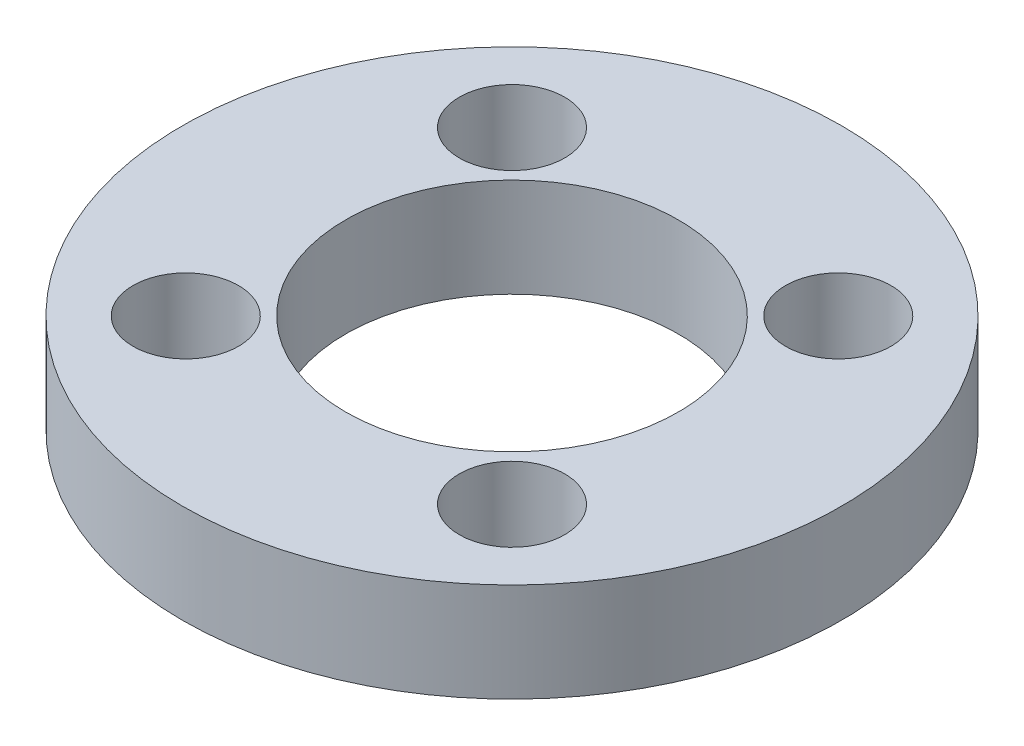
from build123d import *

# Parameters (mm, degrees)
SKETCH_1_R      = 10
SKETCH_1_R_2    = 5.05
SKETCH_1_R_3    = 1.6
EXTRUDE_1_DEPTH = 3


with BuildPart() as part:
    # 草图1 → 凸台-拉伸1 (new body)
    with BuildSketch(Plane(origin=(0, 0, 0), x_dir=(1, 0, 0), z_dir=(0, 1, 0))):
        with Locations(Location((0, 0, 0), (0, 0, 270))):
            Circle(SKETCH_1_R)
        with Locations(Location((0, 0, 0), (0, 0, 270))):
            Circle(SKETCH_1_R_2, mode=Mode.SUBTRACT)
        with Locations(Location((4.949747468, 4.949747468, 0), (0, 0, 270))):
            Circle(SKETCH_1_R_3, mode=Mode.SUBTRACT)
        with Locations(Location((-4.949747468, 4.949747468, 0), (0, 0, 270))):
            Circle(SKETCH_1_R_3, mode=Mode.SUBTRACT)
        with Locations(Location((-4.949747468, -4.949747468, 0), (0, 0, 270))):
            Circle(SKETCH_1_R_3, mode=Mode.SUBTRACT)
        with Locations(Location((4.949747468, -4.949747468, 0), (0, 0, 270))):
            Circle(SKETCH_1_R_3, mode=Mode.SUBTRACT)
    extrude(amount=EXTRUDE_1_DEPTH)


solid = part.part
